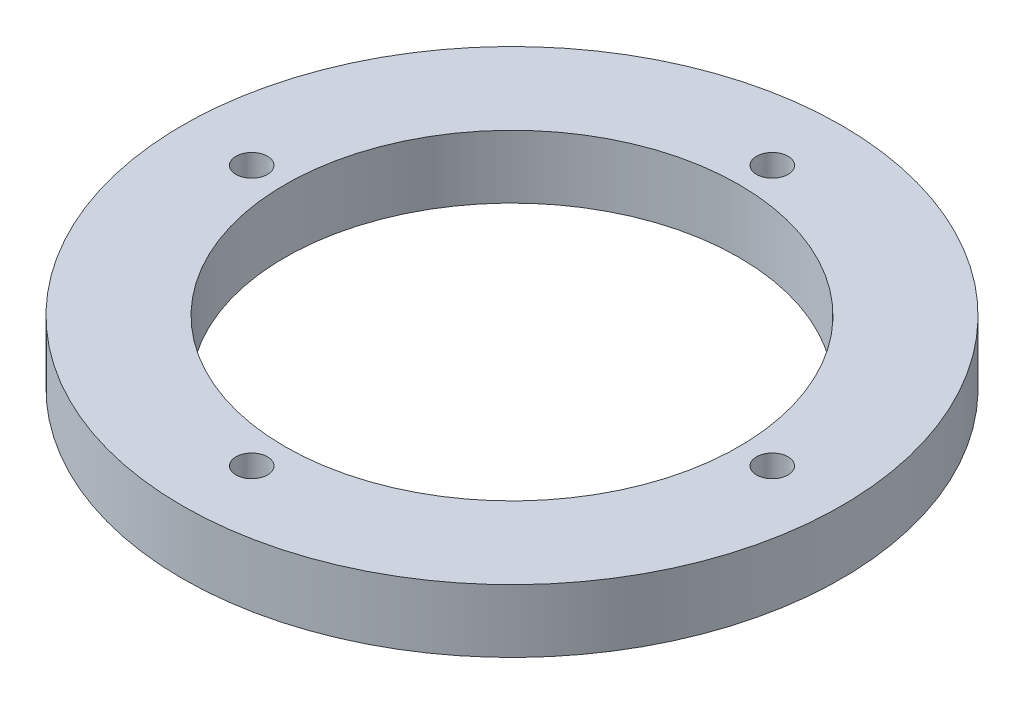
from build123d import *

# Parameters (mm, degrees)
SKETCH1_R           = 26.132445267
SKETCH1_R_2         = 1.25
SKETCH1_R_3         = 18
BOSS_EXTRUDE1_DEPTH = 5


with BuildPart() as part:
    # Sketch1 → Boss-Extrude1 (new body)
    with BuildSketch(Plane(origin=(0, 0, 0), x_dir=(1, 0, 0), z_dir=(0, 1, 0))):
        with Locations(Location((0, 0, 0), (0, 0, 270))):
            Circle(SKETCH1_R)
        with Locations(Location((0, 20.64, 0), (0, 0, 270))):
            Circle(SKETCH1_R_2, mode=Mode.SUBTRACT)
        with Locations(Location((-20.64, 0, 0), (0, 0, 270))):
            Circle(SKETCH1_R_2, mode=Mode.SUBTRACT)
        with Locations(Location((0, -20.64, 0), (0, 0, 270))):
            Circle(SKETCH1_R_2, mode=Mode.SUBTRACT)
        with Locations(Location((20.64, 0, 0), (0, 0, 270))):
            Circle(SKETCH1_R_2, mode=Mode.SUBTRACT)
        with Locations(Location((0, 0, 0), (0, 0, 270))):
            Circle(SKETCH1_R_3, mode=Mode.SUBTRACT)
    extrude(amount=BOSS_EXTRUDE1_DEPTH)


solid = part.part
